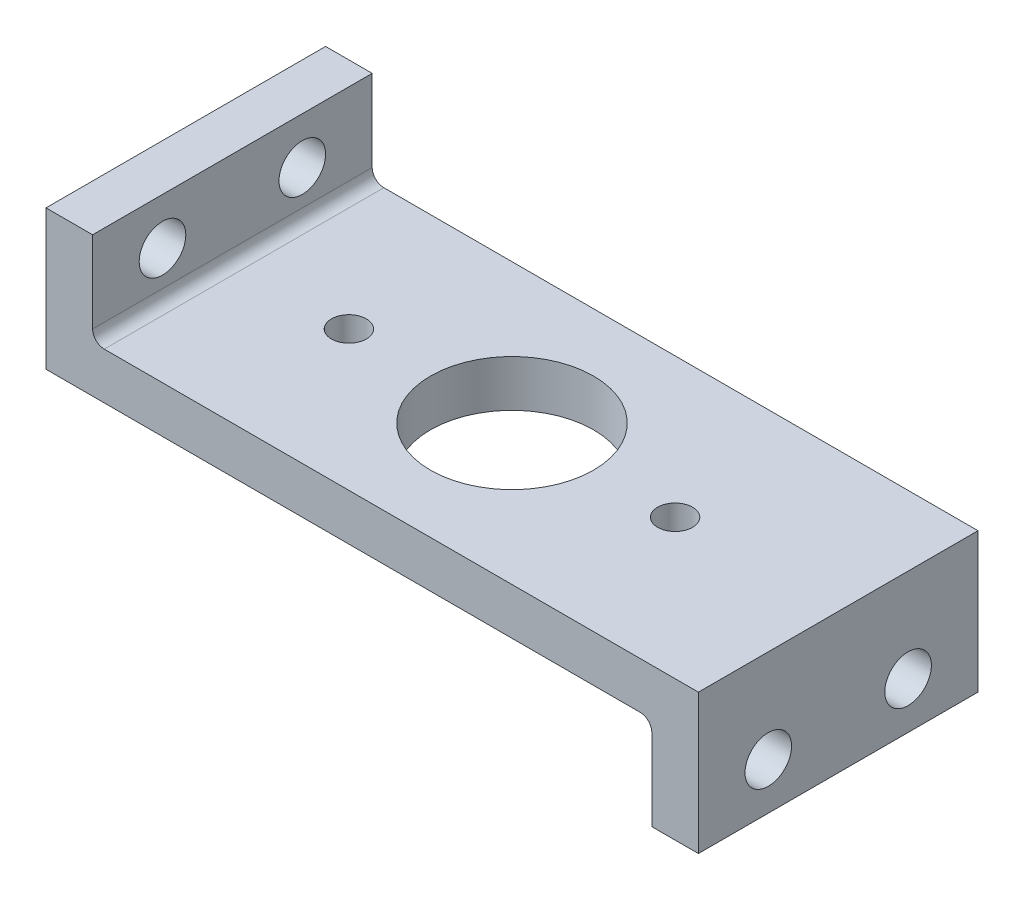
from build123d import *

# Parameters (mm, degrees)
SKETCH1_W               = 177.8
SKETCH1_H               = 76.2
SKETCH1_R               = 22.225
SKETCH1_R_2             = 4.7625
BOSS_EXTRUDE1_DEPTH     = 12.7
SKETCH2_W               = 12.7
SKETCH2_H               = 76.2
BOSS_EXTRUDE2_DEPTH     = 25.4
SKETCH3_W               = 12.7
SKETCH3_H               = 76.2
BOSS_EXTRUDE3_DEPTH     = 25.4
CUT_EXTRUDE1_DEPTH      = 174.669888006
CUT_EXTRUDE1_DEPTH_BACK = 174.669888006
SKETCH4_R               = 6.35
FILLET1_R               = 3.175


with BuildPart() as part:
    # Sketch1 → Boss-Extrude1 (new body)
    with BuildSketch(Plane(origin=(0, 0, 0), x_dir=(1, 0, 0), z_dir=(0, 1, 0))):
        Rectangle(SKETCH1_W, SKETCH1_H)
        with Locations(Location((0, 0, 0), (0, 0, 270))):
            Circle(SKETCH1_R, mode=Mode.SUBTRACT)
        with Locations(Location((-44.45, 0, 0), (0, 0, 270))):
            Circle(SKETCH1_R_2, mode=Mode.SUBTRACT)
        with Locations(Location((44.45, 0, 0), (0, 0, 270))):
            Circle(SKETCH1_R_2, mode=Mode.SUBTRACT)
    extrude(amount=BOSS_EXTRUDE1_DEPTH)

    # Sketch2 → Boss-Extrude2 (add)
    with BuildSketch(Plane(origin=(0, 12.7, 0), x_dir=(1, 0, 0), z_dir=(0, 1, 0))):
        with Locations((-82.55, 0)):
            Rectangle(SKETCH2_W, SKETCH2_H)
    extrude(amount=BOSS_EXTRUDE2_DEPTH)

    # Sketch3 → Boss-Extrude3 (add)
    with BuildSketch(Plane.XZ):
        with Locations((82.55, 0)):
            Rectangle(SKETCH3_W, SKETCH3_H)
    extrude(amount=BOSS_EXTRUDE3_DEPTH)

    # Sketch4 → Cut-Extrude1 (cut, two sides: drawn at the far end of the back side and taken through both)
    with BuildSketch(Plane(origin=(-76.2, 0, 0), x_dir=(0, 0, -1), z_dir=(1, 0, 0)).offset(-CUT_EXTRUDE1_DEPTH_BACK)):
        with Locations((-19.05, 25.4)):
            Circle(SKETCH4_R)
        with Locations((19.05, 25.4)):
            Circle(SKETCH4_R)
        with Locations((-19.05, -12.7)):
            Circle(SKETCH4_R)
        with Locations((19.05, -12.7)):
            Circle(SKETCH4_R)
    extrude(amount=CUT_EXTRUDE1_DEPTH + CUT_EXTRUDE1_DEPTH_BACK, mode=Mode.SUBTRACT)

    # Fillet1
    fillet1_edges = [part.edges().sort_by_distance(p)[0] for p in [
        (-76.2, 12.7, 0),
        (76.2, 0, 0),
    ]]
    fillet(fillet1_edges, radius=FILLET1_R)


solid = part.part
